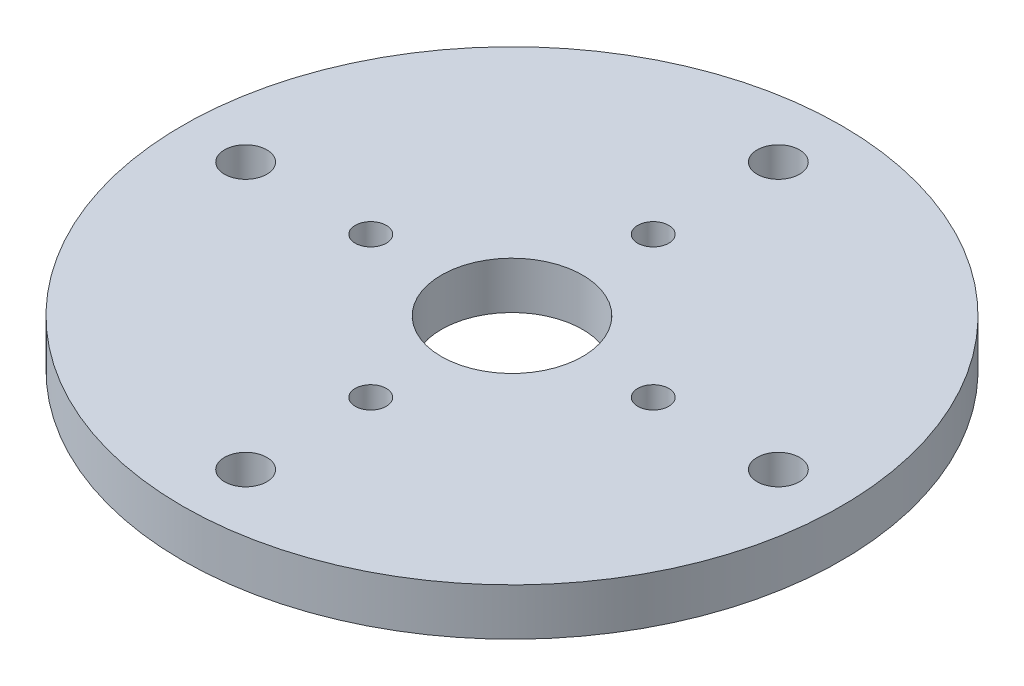
from build123d import *

# Parameters (mm, degrees)
SKETCH1_R           = 35
BOSS_EXTRUDE1_DEPTH = 5
SKETCH2_R           = 2.25
CUT_EXTRUDE1_DEPTH  = 5
CIRPATTERN2_COUNT   = 4
SKETCH3_R           = 1.65
CUT_EXTRUDE2_DEPTH  = 5
CIRPATTERN3_COUNT   = 4
SKETCH4_R           = 7.5
CUT_EXTRUDE3_DEPTH  = 50.749371855


with BuildPart() as part:
    # Sketch1 → Boss-Extrude1 (new body)
    with BuildSketch(Plane(origin=(0, 0, 0), x_dir=(1, 0, 0), z_dir=(0, 1, 0))):
        with Locations(Location((0, 0, 0), (0, 0, 270))):
            Circle(SKETCH1_R)
    extrude(amount=BOSS_EXTRUDE1_DEPTH)

    # Sketch2 → Cut-Extrude1 (cut)
    with BuildSketch(Plane(origin=(0, 5, 0), x_dir=(1, 0, 0), z_dir=(0, 1, 0))):
        with Locations(Location((0, 28.285, 0), (0, 0, 270))):
            Circle(SKETCH2_R)
    cut_extrude1 = extrude(amount=-CUT_EXTRUDE1_DEPTH, mode=Mode.SUBTRACT)

    # CirPattern2: Cut-Extrude1 ×4 about axis
    cirpattern2_axis = Axis((0, 0, 0), (0, 1, 0))
    for i in range(1, CIRPATTERN2_COUNT):
        add(cut_extrude1.rotate(cirpattern2_axis, i * 360 / CIRPATTERN2_COUNT), mode=Mode.SUBTRACT)

    # Sketch3 → Cut-Extrude2 (cut)
    with BuildSketch(Plane(origin=(0, 5, 0), x_dir=(1, 0, 0), z_dir=(0, 1, 0))):
        with Locations(Location((0, 15, 0), (0, 0, 270))):
            Circle(SKETCH3_R)
    cut_extrude2 = extrude(amount=-CUT_EXTRUDE2_DEPTH, mode=Mode.SUBTRACT)

    # CirPattern3: Cut-Extrude2 ×4 about axis
    cirpattern3_axis = Axis((0, 0, 0), (0, 1, 0))
    for i in range(1, CIRPATTERN3_COUNT):
        add(cut_extrude2.rotate(cirpattern3_axis, i * 360 / CIRPATTERN3_COUNT), mode=Mode.SUBTRACT)

    # Sketch4 → Cut-Extrude3 (cut, through all)
    with BuildSketch(Plane(origin=(0, 5, 0), x_dir=(1, 0, 0), z_dir=(0, 1, 0))):
        with Locations(Location((0, 0, 0), (0, 0, 270))):
            Circle(SKETCH4_R)
    extrude(amount=-CUT_EXTRUDE3_DEPTH, mode=Mode.SUBTRACT)


solid = part.part
